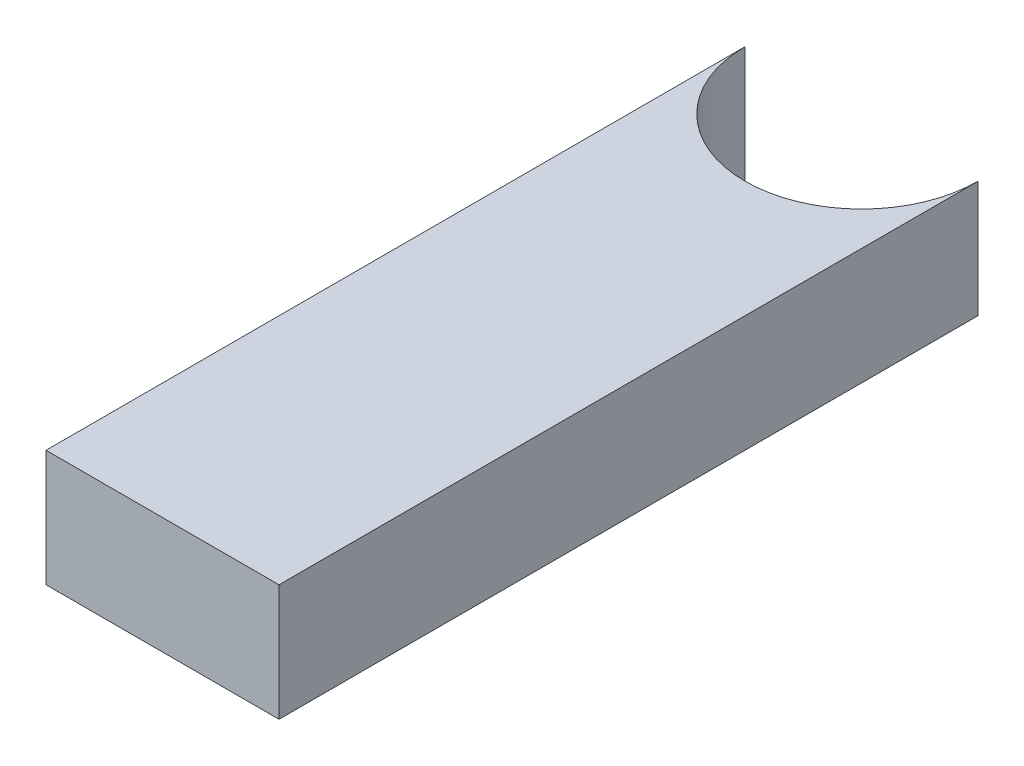
from build123d import *

# Parameters (mm, degrees)
BOSS_EXTRUDE1_DEPTH = 2.54


with BuildPart() as part:
    # Sketch1 → Boss-Extrude1 (new body)
    with BuildSketch(Plane(origin=(0, 0, 0), x_dir=(1, 0, 0), z_dir=(0, 1, 0))):
        with BuildLine():
            Line((0, 15.24), (0, 0))
            Line((0, 0), (5.08, 0))
            Line((5.08, 0), (5.08, 15.24))
            ThreePointArc((5.08, 15.24), (2.54, 12.7), (0, 15.24))
        make_face()
    extrude(amount=BOSS_EXTRUDE1_DEPTH)


solid = part.part
